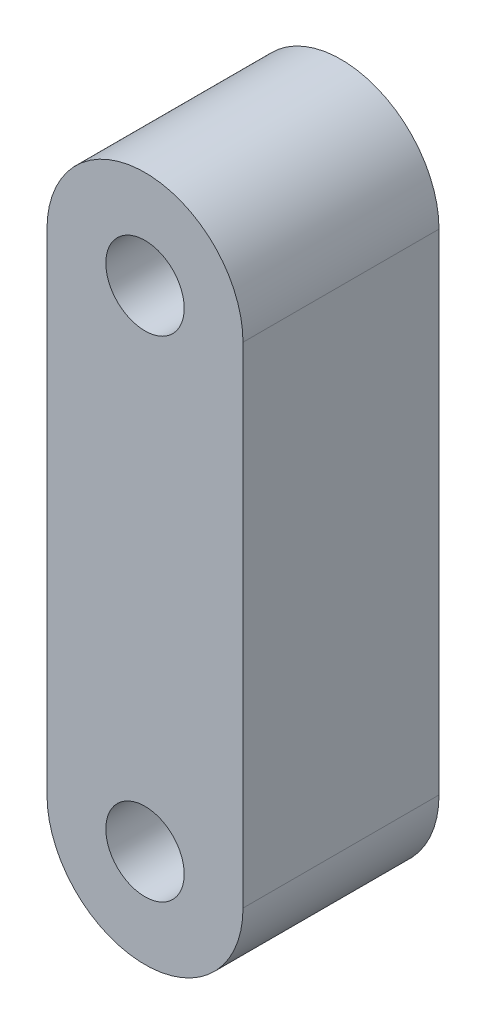
from build123d import *

# Parameters (mm, degrees)
ESQUISSE1_R        = 4
BOSS_EXTRU_1_DEPTH = 20


with BuildPart() as part:
    # Esquisse1 → Boss.-Extru.1 (new body)
    with BuildSketch(Plane.XY):
        with BuildLine():
            Line((-10, 0), (-10, 50))
            ThreePointArc((-10, 50), (0, 60), (10, 50))
            Line((10, 50), (10, 0))
            ThreePointArc((10, 0), (0, -10), (-10, 0))
        make_face()
        with Locations((0, 50)):
            Circle(ESQUISSE1_R, mode=Mode.SUBTRACT)
        Circle(ESQUISSE1_R, mode=Mode.SUBTRACT)
    extrude(amount=BOSS_EXTRU_1_DEPTH)


solid = part.part
